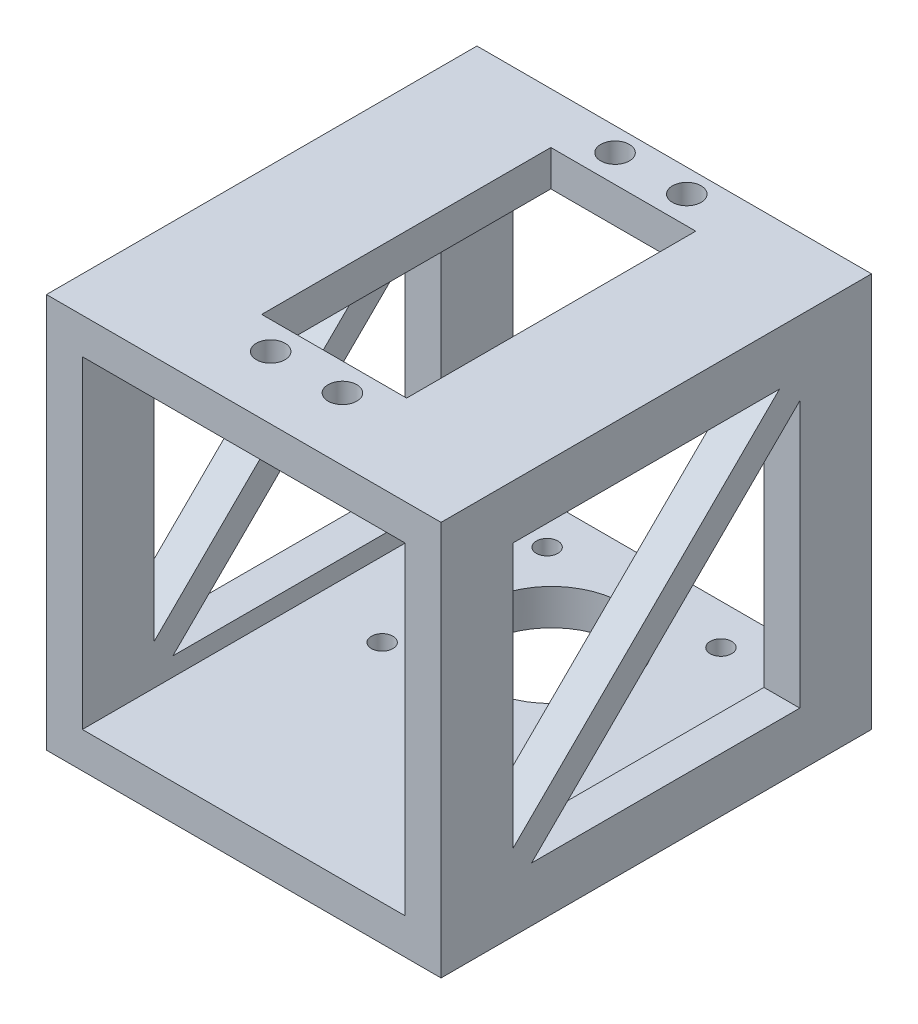
from build123d import *

# Parameters (mm, degrees)
ESQUISSE1_W             = 55
ESQUISSE1_H             = 55
ESQUISSE1_W_2           = 45
ESQUISSE1_H_2           = 45
BOSS_EXTRU_1_DEPTH      = 60
ESQUISSE2_R             = 2
ESQUISSE2_W             = 20.2
ESQUISSE2_H             = 40.3
ENL_V_MAT_EXTRU_1_DEPTH = 10
ESQUISSE5_R             = 10
ESQUISSE5_R_2           = 1.5
ENL_V_MAT_EXTRU_2_DEPTH = 10
ENL_V_MAT_EXTRU_3_DEPTH = 89.413584698


with BuildPart() as part:
    # Esquisse1 → Boss.-Extru.1 (new body)
    with BuildSketch(Plane.XY):
        with Locations((-19.082718041, 7.024802088)):
            Rectangle(ESQUISSE1_W, ESQUISSE1_H)
        with Locations((-19.082718041, 7.024802088)):
            Rectangle(ESQUISSE1_W_2, ESQUISSE1_H_2, mode=Mode.SUBTRACT)
    extrude(amount=BOSS_EXTRU_1_DEPTH)

    # Esquisse2 → Enlèv. mat.-Extru.1 (cut)
    with BuildSketch(Plane(origin=(0, 34.524802088, 0), x_dir=(1, 0, 0), z_dir=(0, 1, 0))):
        with Locations(Location((-24.082718041, -3.25, 0), (0, 0, 270))):
            Circle(ESQUISSE2_R)
        with Locations(Location((-14.082718041, -3.25, 0), (0, 0, 270))):
            Circle(ESQUISSE2_R)
        with Locations(Location((-24.082718041, -51.25, 0), (0, 0, 270))):
            Circle(ESQUISSE2_R)
        with Locations(Location((-14.082718041, -51.25, 0), (0, 0, 270))):
            Circle(ESQUISSE2_R)
        with Locations((-19.082718041, -27.25)):
            Rectangle(ESQUISSE2_W, ESQUISSE2_H)
    extrude(amount=-ENL_V_MAT_EXTRU_1_DEPTH, mode=Mode.SUBTRACT)

    # Esquisse5 → Enlèv. mat.-Extru.2 (cut)
    with BuildSketch(Plane.XZ.offset(20.475197912)):
        with Locations(Location((-19.082718041, 17.1, 0), (0, 0, 270))):
            Circle(ESQUISSE5_R)
        with Locations(Location((-31.197044543, 5.605084019, 0), (0, 0, 270))):
            Circle(ESQUISSE5_R_2)
        with Locations(Location((-6.968391539, 5.605084019, 0), (0, 0, 270))):
            Circle(ESQUISSE5_R_2)
        with Locations(Location((-31.197044543, 28.594915981, 0), (0, 0, 270))):
            Circle(ESQUISSE5_R_2)
        with Locations(Location((-6.968391539, 28.594915981, 0), (0, 0, 270))):
            Circle(ESQUISSE5_R_2)
    extrude(amount=-ENL_V_MAT_EXTRU_2_DEPTH, mode=Mode.SUBTRACT)

    # Esquisse8 → Enlèv. mat.-Extru.3 (cut, through all)
    with BuildSketch(Plane(origin=(8.417281959, 0, 0), x_dir=(0, 0, -1), z_dir=(1, 0, 0))):
        Polygon((-50, 27.024802088), (-12.828427125, 27.024802088), (-50, -9.859909005), align=None)
        Polygon((-47.383863207, -12.898988168), (-10, -12.898988168), (-10, 24.196374963), align=None)
    extrude(amount=-ENL_V_MAT_EXTRU_3_DEPTH, mode=Mode.SUBTRACT)


solid = part.part
